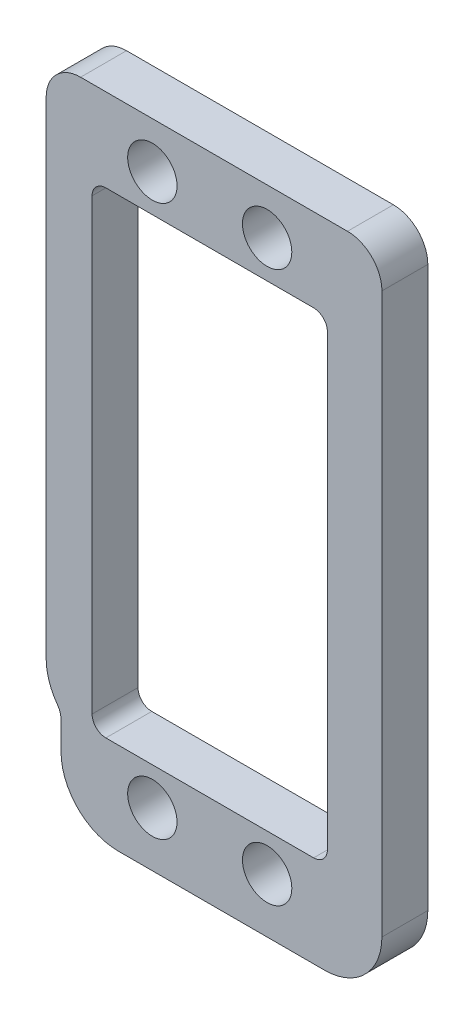
from build123d import *

# Parameters (mm, degrees)
SKETCH_1_W           = 100
SKETCH_1_H           = 100
EXTRUDE_1_DEPTH      = 4
SKETCH_2_R           = 2.15
CUT_EXTRUDE_1_DEPTH  = 142.477913471
SKETCH_3_R           = 1.65
CUT_EXTRUDE_2_DEPTH  = 142.477913471
SKETCH_4_R           = 1.65
CUT_EXTRUDE_3_DEPTH  = 142.477913471
SKETCH_5_W           = 20.5
SKETCH_5_H           = 41.5
CUT_EXTRUDE_4_DEPTH  = 10
SKETCH_6_W           = 55
SKETCH_6_H           = 100
CUT_EXTRUDE_5_DEPTH  = 10
FILLET_2_R           = 1.2
SKETCH_8_R           = 1.65
CUT_EXTRUDE_6_DEPTH  = 142.477913471
SKETCH_9_W           = 15.75
SKETCH_9_H           = 78.5
CUT_EXTRUDE_7_DEPTH  = 142.477913471
CUT_EXTRUDE_8_DEPTH  = 10
FILLET_5_R           = 3
SKETCH_11_W          = 29.25
SKETCH_11_H          = 14
CUT_EXTRUDE_9_DEPTH  = 10
FILLET_7_R           = 3
SKETCH_12_R          = 1.65
CUT_EXTRUDE_10_DEPTH = 10
FILLET_8_R           = 3
EXTRUDE_2_DEPTH      = 4
FILLET_9_R           = 5
CUT_EXTRUDE_11_DEPTH = 10
FILLET_10_R          = 1.7
SKETCH_15_R          = 1.65
CUT_EXTRUDE_12_DEPTH = 10
FILLET_11_R          = 5


with BuildPart() as part:
    # 草图1 → 凸台-拉伸1 (new body)
    with BuildSketch(Plane.XY):
        with Locations((50, -50)):
            Rectangle(SKETCH_1_W, SKETCH_1_H)
    extrude(amount=EXTRUDE_1_DEPTH)

    # 草图2 → 切除-拉伸1 (cut, through all)
    with BuildSketch(Plane.XY.offset(4)):
        with Locations((80, -66)):
            Circle(SKETCH_2_R)
        with Locations((90, -66)):
            Circle(SKETCH_2_R)
        with Locations((90, -18)):
            Circle(SKETCH_2_R)
        with Locations((80, -18)):
            Circle(SKETCH_2_R)
    extrude(amount=-CUT_EXTRUDE_1_DEPTH, mode=Mode.SUBTRACT)

    # 草图3 → 切除-拉伸2 (cut, through all)
    with BuildSketch(Plane.XY.offset(4)):
        with Locations((73, -95)):
            Circle(SKETCH_3_R)
        with Locations((73, -85)):
            Circle(SKETCH_3_R)
        with Locations((85, -85)):
            Circle(SKETCH_3_R)
        with Locations((85, -95)):
            Circle(SKETCH_3_R)
    extrude(amount=-CUT_EXTRUDE_2_DEPTH, mode=Mode.SUBTRACT)

    # 草图4 → 切除-拉伸3 (cut, through all)
    with BuildSketch(Plane.XY.offset(4)):
        with BuildLine():
            ThreePointArc((81, -100), (71.5, -90.5), (62, -100))
            Line((62, -100), (81, -100))
        make_face()
        with Locations((73, -95)):
            Circle(SKETCH_4_R, mode=Mode.SUBTRACT)
    extrude(amount=-CUT_EXTRUDE_3_DEPTH, mode=Mode.SUBTRACT)

    # 草图5 → 切除-拉伸4 (cut)
    with BuildSketch(Plane.XY.offset(4)):
        with Locations((85, -42)):
            Rectangle(SKETCH_5_W, SKETCH_5_H)
    extrude(amount=-CUT_EXTRUDE_4_DEPTH, mode=Mode.SUBTRACT)

    # 草图6 → 切除-拉伸5 (cut)
    with BuildSketch(Plane.XY.offset(4)):
        with Locations((27.5, -50)):
            Rectangle(SKETCH_6_W, SKETCH_6_H)
    extrude(amount=-CUT_EXTRUDE_5_DEPTH, mode=Mode.SUBTRACT)

    # 圆角2
    fillet_2_edges = [part.edges().sort_by_distance(p)[0] for p in [
        (95.25, -62.75, 2),
        (74.75, -62.75, 2),
        (74.75, -21.25, 2),
        (95.25, -21.25, 2),
    ]]
    fillet(fillet_2_edges, radius=FILLET_2_R)

    # 草图8 → 切除-拉伸6 (cut, through all)
    with BuildSketch(Plane.XY.offset(4)):
        with Locations((59, -85)):
            Circle(SKETCH_8_R)
    extrude(amount=-CUT_EXTRUDE_6_DEPTH, mode=Mode.SUBTRACT)

    # 草图9 → 切除-拉伸7 (cut, through all)
    with BuildSketch(Plane.XY.offset(4)):
        with BuildLine():
            Line((71.5, -90.5), (55, -90.5))
            Line((55, -90.5), (55, -100))
            Line((55, -100), (62, -100))
            ThreePointArc((62, -100), (64.782485579, -93.282485579), (71.5, -90.5))
        make_face()
        with Locations((62.875, -39.25)):
            Rectangle(SKETCH_9_W, SKETCH_9_H)
    extrude(amount=-CUT_EXTRUDE_7_DEPTH, mode=Mode.SUBTRACT)

    # 草图10 → 切除-拉伸8 (cut)
    with BuildSketch(Plane.XY.offset(4)):
        with BuildLine():
            Line((100, -87.5), (55, -87.5))
            Line((55, -87.5), (55, -90.5))
            Line((55, -90.5), (71.5, -90.5))
            ThreePointArc((71.5, -90.5), (78.217514421, -93.282485579), (81, -100))
            Line((81, -100), (100, -100))
            Line((100, -100), (100, -87.5))
        make_face()
    extrude(amount=-CUT_EXTRUDE_8_DEPTH, mode=Mode.SUBTRACT)

    # 圆角5
    fillet_5_edges = [part.edges().sort_by_distance(p)[0] for p in [
        (100, -87.5, 2),
        (55, -87.5, 2),
    ]]
    fillet(fillet_5_edges, radius=FILLET_5_R)

    # 草图11 → 切除-拉伸9 (cut)
    with BuildSketch(Plane.XY.offset(4)):
        with Locations((85.375, -7)):
            Rectangle(SKETCH_11_W, SKETCH_11_H)
    extrude(amount=-CUT_EXTRUDE_9_DEPTH, mode=Mode.SUBTRACT)

    # 圆角7
    fillet_7_edges = [part.edges().sort_by_distance(p)[0] for p in [
        (70.75, -14, 2),
        (100, -14, 2),
    ]]
    fillet(fillet_7_edges, radius=FILLET_7_R)

    # 草图12 → 切除-拉伸10 (cut)
    with BuildSketch(Plane.XY.offset(4)):
        with BuildLine():
            Line((64.339745962, -87.5), (81.660254038, -87.5))
            ThreePointArc((81.660254038, -87.5), (73, -82.5), (64.339745962, -87.5))
        make_face()
        with Locations((73, -85)):
            Circle(SKETCH_12_R, mode=Mode.SUBTRACT)
    extrude(amount=-CUT_EXTRUDE_10_DEPTH, mode=Mode.SUBTRACT)

    # 圆角8
    fillet_8_edges = [part.edges().sort_by_distance(p)[0] for p in [
        (64.339745962, -87.5, 2),
        (81.660254038, -87.5, 2),
    ]]
    fillet(fillet_8_edges, radius=FILLET_8_R)

    # 草图13 → 凸台-拉伸2 (add)
    with BuildSketch(Plane.XY.offset(4)):
        Polygon((70.75, -51.220199781), (55, -78.5), (70.75, -78.5), align=None)
    extrude(amount=-EXTRUDE_2_DEPTH)

    # 圆角9
    fillet_9_edges = [part.edges().sort_by_distance(p)[0] for p in [
        (55, -78.5, 2),
        (70.75, -51.220199781, 2),
    ]]
    fillet(fillet_9_edges, radius=FILLET_9_R)

    # 草图14 → 切除-拉伸11 (cut)
    with BuildSketch(Plane.XY.offset(4)):
        Polygon((72.044228634, -79.339745962), (72.044228634, -56.97853003), (59.133974596, -79.339745962), align=None)
    extrude(amount=-CUT_EXTRUDE_11_DEPTH, mode=Mode.SUBTRACT)

    # 圆角10
    fillet_10_edges = [part.edges().sort_by_distance(p)[0] for p in [
        (72.044228634, -79.339745962, 2),
        (59.133974596, -79.339745962, 2),
        (72.044228634, -56.97853003, 2),
    ]]
    fillet(fillet_10_edges, radius=FILLET_10_R)

    # 草图15 → 切除-拉伸12 (cut)
    # profile 1 of 4: a face of its own
    with BuildSketch(Plane(origin=(0, 0, 0), x_dir=(-1, 0, 0), z_dir=(0, 0, -1))):
        with BuildLine():
            Line((-59.474464586, -70.75), (-55.667552662, -70.75))
            Line((-55.667552662, -70.75), (-55.667552662, -49.880453819))
            Line((-55.667552662, -49.880453819), (-70.75, -49.880453819))
            ThreePointArc((-70.75, -49.880453819), (-70.579629131, -51.174549044), (-70.080127019, -52.380453819))
            Line((-70.080127019, -52.380453819), (-59.474464586, -70.75))
        make_face()
    # profile 2 of 4: a face of its own
    with BuildSketch(Plane(origin=(0, 0, 0), x_dir=(-1, 0, 0), z_dir=(0, 0, -1))):
        with BuildLine():
            Line((-41.658398954, -70.75), (-55.667552662, -70.75))
            Line((-55.667552662, -70.75), (-59.474464586, -70.75))
            Line((-59.474464586, -70.75), (-55.669872981, -77.339745962))
            ThreePointArc((-55.669872981, -77.339745962), (-55.170370869, -78.545650737), (-55, -79.839745962))
            Line((-55, -79.839745962), (-55, -84.5))
            ThreePointArc((-55, -84.5), (-55.878679656, -86.621320344), (-58, -87.5))
            Line((-58, -87.5), (-62.753049234, -87.5))
            ThreePointArc((-62.753049234, -87.5), (-64.068636263, -87.196151103), (-65.11773018, -86.346153846))
            ThreePointArc((-65.11773018, -86.346153846), (-73, -82.5), (-80.88226982, -86.346153846))
            ThreePointArc((-80.88226982, -86.346153846), (-81.931363737, -87.196151103), (-83.246950766, -87.5))
            Line((-83.246950766, -87.5), (-97, -87.5))
            ThreePointArc((-97, -87.5), (-99.121320344, -86.621320344), (-100, -84.5))
            Line((-100, -84.5), (-100, -90.078728051))
            Line((-100, -90.078728051), (-41.658398954, -90.078728051))
            Line((-41.658398954, -90.078728051), (-41.658398954, -70.75))
        make_face()
    # profile 3 of 4: a face of its own
    with BuildSketch(Plane(origin=(0, 0, 0), x_dir=(-1, 0, 0), z_dir=(0, 0, -1))):
        with BuildLine():
            Line((-55.669872981, -77.339745962), (-59.474464586, -70.75))
            Line((-59.474464586, -70.75), (-64.09326674, -70.75))
            Line((-64.09326674, -70.75), (-60.606217783, -76.789745962))
            ThreePointArc((-60.606217783, -76.789745962), (-60.606217783, -78.489745962), (-62.078460969, -79.339745962))
            Line((-62.078460969, -79.339745962), (-70.344228634, -79.339745962))
            ThreePointArc((-70.344228634, -79.339745962), (-71.546310162, -78.84182749), (-72.044228634, -77.639745962))
            Line((-72.044228634, -77.639745962), (-72.044228634, -70.75))
            Line((-72.044228634, -70.75), (-100, -70.75))
            Line((-100, -70.75), (-100, -84.5))
            ThreePointArc((-100, -84.5), (-99.121320344, -86.621320344), (-97, -87.5))
            Line((-97, -87.5), (-83.246950766, -87.5))
            ThreePointArc((-83.246950766, -87.5), (-81.931363737, -87.196151103), (-80.88226982, -86.346153846))
            ThreePointArc((-80.88226982, -86.346153846), (-73, -82.5), (-65.11773018, -86.346153846))
            ThreePointArc((-65.11773018, -86.346153846), (-64.068636263, -87.196151103), (-62.753049234, -87.5))
            Line((-62.753049234, -87.5), (-58, -87.5))
            ThreePointArc((-58, -87.5), (-55.878679656, -86.621320344), (-55, -84.5))
            Line((-55, -84.5), (-55, -79.839745962))
            ThreePointArc((-55, -79.839745962), (-55.170370869, -78.545650737), (-55.669872981, -77.339745962))
        make_face()
        with Locations((-85, -85)):
            Circle(SKETCH_15_R, mode=Mode.SUBTRACT)
        with Locations((-59, -85)):
            Circle(SKETCH_15_R, mode=Mode.SUBTRACT)
    # profile 4 of 4: a face of its own
    with BuildSketch(Plane(origin=(0, 0, 0), x_dir=(-1, 0, 0), z_dir=(0, 0, -1))):
        with BuildLine():
            Line((-64.09326674, -70.75), (-59.474464586, -70.75))
            Line((-59.474464586, -70.75), (-70.080127019, -52.380453819))
            ThreePointArc((-70.080127019, -52.380453819), (-70.579629131, -51.174549044), (-70.75, -49.880453819))
            Line((-70.75, -49.880453819), (-70.75, -61.672153114))
            ThreePointArc((-70.75, -61.672153114), (-69.677380797, -61.759266435), (-68.871985448, -62.473016403))
            Line((-68.871985448, -62.473016403), (-64.09326674, -70.75))
        make_face()
    extrude(amount=-CUT_EXTRUDE_12_DEPTH, mode=Mode.SUBTRACT)

    # 圆角11
    fillet_11_edges = [part.edges().sort_by_distance(p)[0] for p in [
        (70.75, -61.672153114, 2),
        (100, -70.75, 2),
        (72.044228634, -70.75, 2),
    ]]
    fillet(fillet_11_edges, radius=FILLET_11_R)


solid = part.part
